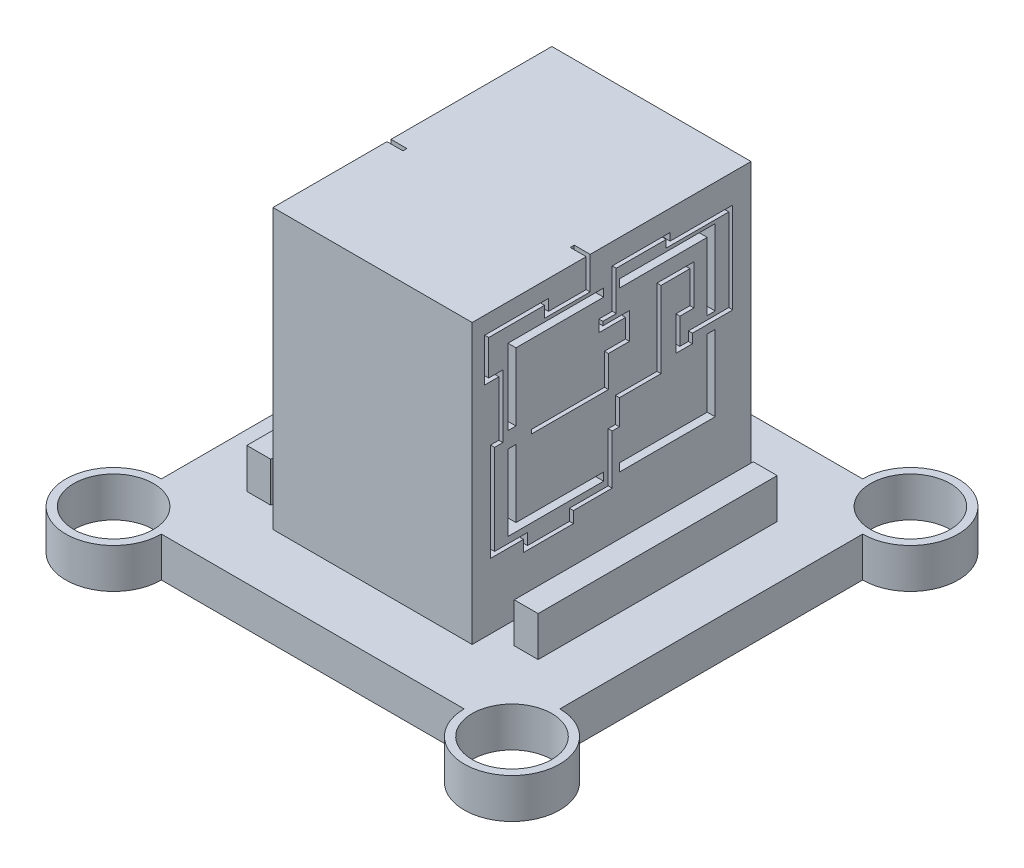
from build123d import *

# Parameters (mm, degrees)
SKETCH1_R           = 0.3
SKETCH1_W           = 2.5
SKETCH1_H           = 2.5
BOSS_EXTRUDE1_DEPTH = 0.25
SKETCH2_R           = 0.25
CUT_EXTRUDE1_DEPTH  = 0.25
SKETCH3_W           = 0.15
SKETCH3_H           = 1.5
BOSS_EXTRUDE2_DEPTH = 0.25
SKETCH4_W           = 1.25
SKETCH4_H           = 1.75
BOSS_EXTRUDE3_DEPTH = 1.75
CUT_EXTRUDE7_DEPTH  = 1.25
CUT_EXTRUDE9_DEPTH  = 0.1
SCALE1_SCALE        = 5


with BuildPart() as part:
    # Sketch1 → Boss-Extrude1 (new body)
    with BuildSketch(Plane(origin=(0, 0, 0), x_dir=(1, 0, 0), z_dir=(0, 1, 0))):
        with Locations((-1.25, -1.25)):
            Circle(SKETCH1_R)
        with Locations((1.25, -1.25)):
            Circle(SKETCH1_R)
        with Locations((1.25, 1.25)):
            Circle(SKETCH1_R)
        with Locations((-1.25, 1.25)):
            Circle(SKETCH1_R)
        Rectangle(SKETCH1_W, SKETCH1_H)
        with BuildLine():
            Line((-1.25, -0.95), (-1.25, -1.25))
            Line((-1.25, -1.25), (-0.95, -1.25))
            ThreePointArc((-0.95, -1.25), (-1.037867966, -1.037867966), (-1.25, -0.95))
        make_face()
        with BuildLine():
            Line((-0.95, -1.25), (-1.25, -1.25))
            Line((-1.25, -1.25), (-1.25, -0.95))
            ThreePointArc((-1.25, -0.95), (-1.462132034, -1.462132034), (-0.95, -1.25))
        make_face()
        with BuildLine():
            ThreePointArc((1.25, -0.95), (1.037867966, -1.037867966), (0.95, -1.25))
            Line((0.95, -1.25), (1.25, -1.25))
            Line((1.25, -1.25), (1.25, -0.95))
        make_face()
        with BuildLine():
            Line((1.25, -1.25), (0.95, -1.25))
            ThreePointArc((0.95, -1.25), (1.25, -1.55), (1.55, -1.25))
            ThreePointArc((1.55, -1.25), (1.462132034, -1.037867966), (1.25, -0.95))
            Line((1.25, -0.95), (1.25, -1.25))
        make_face()
        with BuildLine():
            ThreePointArc((0.95, 1.25), (1.037867966, 1.037867966), (1.25, 0.95))
            Line((1.25, 0.95), (1.25, 1.25))
            Line((1.25, 1.25), (0.95, 1.25))
        make_face()
        with BuildLine():
            Line((1.25, 1.25), (1.25, 0.95))
            ThreePointArc((1.25, 0.95), (1.462132034, 1.037867966), (1.55, 1.25))
            ThreePointArc((1.55, 1.25), (1.25, 1.55), (0.95, 1.25))
            Line((0.95, 1.25), (1.25, 1.25))
        make_face()
        with BuildLine():
            ThreePointArc((-0.95, 1.25), (-1.462132034, 1.462132034), (-1.25, 0.95))
            Line((-1.25, 0.95), (-1.25, 1.25))
            Line((-1.25, 1.25), (-0.95, 1.25))
        make_face()
        with BuildLine():
            Line((-1.25, 1.25), (-1.25, 0.95))
            ThreePointArc((-1.25, 0.95), (-1.037867966, 1.037867966), (-0.95, 1.25))
            Line((-0.95, 1.25), (-1.25, 1.25))
        make_face()
    extrude(amount=BOSS_EXTRUDE1_DEPTH)

    # Sketch2 → Cut-Extrude1 (cut)
    with BuildSketch(Plane(origin=(0, 0.25, 0), x_dir=(1, 0, 0), z_dir=(0, 1, 0))):
        with Locations(Location((-1.25, 1.25, 0), (0, 0, 270))):
            Circle(SKETCH2_R)
        with Locations(Location((1.25, 1.25, 0), (0, 0, 270))):
            Circle(SKETCH2_R)
        with Locations(Location((1.25, -1.25, 0), (0, 0, 270))):
            Circle(SKETCH2_R)
        with Locations(Location((-1.25, -1.25, 0), (0, 0, 270))):
            Circle(SKETCH2_R)
    extrude(amount=-CUT_EXTRUDE1_DEPTH, mode=Mode.SUBTRACT)

    # Sketch3 → Boss-Extrude2 (add)
    with BuildSketch(Plane(origin=(0, 0.25, 0), x_dir=(1, 0, 0), z_dir=(0, 1, 0))):
        with Locations((-0.83902568, 0)):
            Rectangle(SKETCH3_W, SKETCH3_H)
        with Locations((0.83902568, 0)):
            Rectangle(SKETCH3_W, SKETCH3_H)
    extrude(amount=BOSS_EXTRUDE2_DEPTH)

    # Sketch4 → Boss-Extrude3 (add)
    with BuildSketch(Plane(origin=(0, 0.25, 0), x_dir=(1, 0, 0), z_dir=(0, 1, 0))):
        Rectangle(SKETCH4_W, SKETCH4_H)
    extrude(amount=BOSS_EXTRUDE3_DEPTH)

    # Sketch5 → Cut-Extrude7 (cut)
    with BuildSketch(Plane(origin=(0.625, 0, 0), x_dir=(0, 0, -1), z_dir=(1, 0, 0))):
        Polygon((-0.65, 1.775), (-0.05, 1.775), (-0.05, 1.725), (-0.6, 1.725), (-0.6, 1.3), (-0.65, 1.3), align=None)
        Polygon((0.65, 0.725), (0.65, 1.2), (0.6, 1.2), (0.6, 0.775), (0.05, 0.775), (0.05, 0.725), align=None)
        Polygon((-0.65, 0.725), (-0.05, 0.725), (-0.05, 0.775), (-0.6, 0.775), (-0.6, 1.2), (-0.65, 1.2), align=None)
        Polygon((0.05, 1.775), (0.05, 1.725), (0.6, 1.725), (0.6, 1.3), (0.65, 1.3), (0.65, 1.775), align=None)
    extrude(amount=-CUT_EXTRUDE7_DEPTH, mode=Mode.SUBTRACT)

    # Sketch8 → Cut-Extrude9 (cut)
    with BuildSketch(Plane(origin=(0.625, 0, 0), x_dir=(0, 0, -1), z_dir=(1, 0, 0))):
        Polygon((-0.503375897, 1.232818327), (-0.044677147, 1.232818327), (-0.044677147, 1.428881596), (0.08715721, 1.428881596), (0.08715721, 1.546589067), (-0.079677023, 1.546589067), (-0.079677023, 1.62114647), (0.003740094, 1.62114647), (0.003740094, 1.867896489), (0.367449459, 1.867896489), (0.367449459, 1.820821453), (0.76019226, 1.820821453), (0.76019226, 1.250813491), (0.506643328, 1.250813491), (0.506643328, 1.193247307), (0.403478741, 1.193247307), (0.403478741, 1.40774477), (0.49207468, 1.40774477), (0.49207468, 1.608985408), (0.310029647, 1.608985408), (0.310029647, 1.129297272), (0.049220472, 1.129297272), (0.049220472, 0.970916557), (0.003740094, 0.970916557), (0.003740094, 0.660265926), (-0.239434859, 0.660265926), (-0.239434859, 0.588970835), (-0.552853671, 0.588970835), (-0.552853671, 0.660265926), (-0.759218815, 0.660265926), (-0.759218815, 1.276016357), (-0.707233319, 1.276016357), (-0.707233319, 1.62114647), (-0.796105653, 1.62114647), (-0.796105653, 1.891392915), (-0.396144265, 1.891392915), (-0.396144265, 1.820821453), (-0.159440431, 1.820821453), (-0.159440431, 2), (-0.134440431, 2), (-0.134440431, 1.795821453), (-0.421144265, 1.795821453), (-0.421144265, 1.866392915), (-0.771105653, 1.866392915), (-0.771105653, 1.64614647), (-0.682233319, 1.64614647), (-0.682233319, 1.251016357), (-0.734218815, 1.251016357), (-0.734218815, 0.685265926), (-0.527853671, 0.685265926), (-0.527853671, 0.613970835), (-0.264434859, 0.613970835), (-0.264434859, 0.685265926), (-0.021259906, 0.685265926), (-0.021259906, 0.995916557), (0.024220472, 0.995916557), (0.024220472, 1.154297272), (0.285029647, 1.154297272), (0.285029647, 1.633985408), (0.51707468, 1.633985408), (0.51707468, 1.38274477), (0.428478741, 1.38274477), (0.428478741, 1.218247307), (0.481643328, 1.218247307), (0.481643328, 1.275813491), (0.73519226, 1.275813491), (0.73519226, 1.795821453), (0.342449459, 1.795821453), (0.342449459, 1.842896489), (0.028740094, 1.842896489), (0.028740094, 1.59614647), (-0.054677023, 1.59614647), (-0.054677023, 1.571589067), (0.11215721, 1.571589067), (0.11215721, 1.403881596), (-0.019677147, 1.403881596), (-0.019677147, 1.207818327), (-0.503375897, 1.207818327), align=None)
    cut_extrude9 = extrude(amount=-CUT_EXTRUDE9_DEPTH, mode=Mode.SUBTRACT)

    # Mirror2: Cut-Extrude9 across plane
    add(cut_extrude9.mirror(Plane(origin=(0, 0, 0), x_dir=(0, 0, 1), z_dir=(1, 0, 0))), mode=Mode.SUBTRACT)


with BuildPart() as part_1:
    # Scale1: scaled about (0, 0.798499331, -0.000347304)
    add(part.part.scale(SCALE1_SCALE).moved(Location((0, -3.193997324, 0.001389216))))


solid = part_1.part
